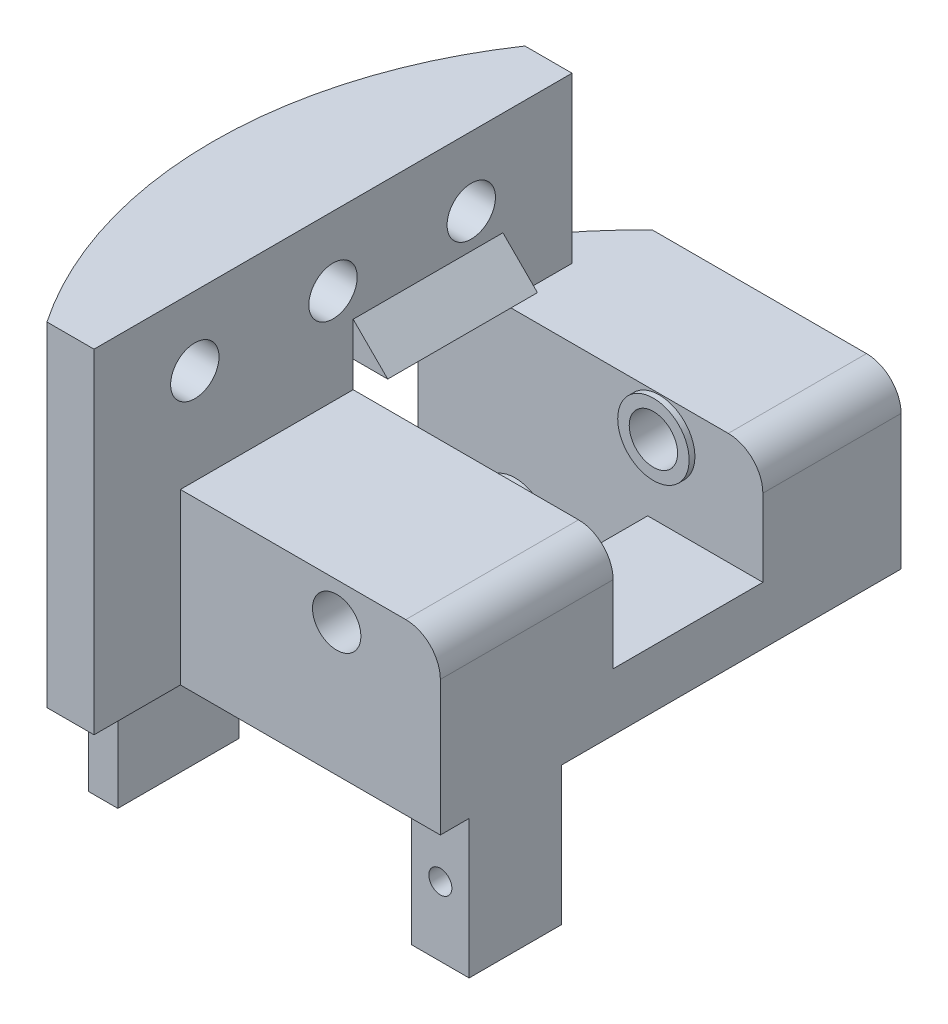
from build123d import *
from build123d.topology import SkipClean

# Parameters (mm, degrees)
BOSS_EXTRUDE1_DEPTH       = 12
SKETCH1_W                 = 5
SKETCH1_H                 = 8
BOSS_EXTRUDE1_2_DEPTH     = 12
BOSS_EXTRUDE2_DEPTH       = 17
F_2_0MM_DOWEL_HOLE1_D     = 2
F_2_0MM_DOWEL_HOLE1_DEPTH = 8
BOSS_EXTRUDE6_START       = -17
BOSS_EXTRUDE6_DEPTH       = 17
BOSS_EXTRUDE8_DEPTH       = 12
CUT_EXTRUDE2_REACH        = 70.191
SKETCH5_R                 = 2.1
CUT_EXTRUDE3_REACH        = 70.191
SKETCH19_W                = 22.567285658
SKETCH19_H                = 2.3
CUT_EXTRUDE5_START        = -2.3
CUT_EXTRUDE5_DEPTH        = 2.3
SKETCH21_W                = 10
SKETCH21_H                = 13
BOSS_EXTRUDE10_DEPTH      = 5
FILLET3_R                 = 3
SKETCH23_R                = 3.1
SKETCH23_R_2              = 2.1
BOSS_EXTRUDE11_DEPTH      = 0.5
CUT_EXTRUDE6_START        = -1.5
SKETCH24_W                = 5
SKETCH24_H                = 12
SKETCH24_R                = 1
CUT_EXTRUDE6_DEPTH        = 1.5
BOSS_EXTRUDE12_START      = -9.5
SKETCH24_2_W              = 5
SKETCH24_2_H              = 12
SKETCH24_2_R              = 1
BOSS_EXTRUDE12_DEPTH      = 1.5
F_2_0MM_DOWEL_HOLE2_D     = 4.2
BOSS_EXTRUDE13_START      = 17
BOSS_EXTRUDE13_DEPTH      = 17
BOSS_EXTRUDE14_DEPTH      = 13


with BuildPart() as part:
    # Sketch1 → Boss-Extrude1 (new body)
    with BuildSketch(Plane(origin=(0, 0, 0), x_dir=(1, 0, 0), z_dir=(0, 1, 0))):
        with BuildLine():
            Line((-31.978879107, -1.25), (-36.978879107, -1.25))
            ThreePointArc((-36.978879107, -1.25), (-36.262349279, -7.351328095), (-34.546164765, -13.25))
            Line((-34.546164765, -13.25), (-31.978879107, -13.25))
            Line((-31.978879107, -13.25), (-31.978879107, -1.25))
        make_face()
    extrude(amount=BOSS_EXTRUDE1_DEPTH)



with BuildPart() as body_2:
    # Sketch1 → Boss-Extrude1 2 (new body)
    with BuildSketch(Plane(origin=(0, 0, 0), x_dir=(1, 0, 0), z_dir=(0, 1, 0))):
        with Locations((-6.478879107, -5.25)):
            Rectangle(SKETCH1_W, SKETCH1_H)
    extrude(amount=BOSS_EXTRUDE1_2_DEPTH)


with BuildPart() as part_1:
    add(part.part)

    add(body_2.part)  # Boss-Extrude2 merges body 2
    # Sketch2 → Boss-Extrude2 (add)
    with BuildSketch(Plane(origin=(0, 12, 0), x_dir=(1, 0, 0), z_dir=(0, 1, 0))):
        with BuildLine():
            Line((-3.978879107, -13.25), (-3.978879107, 1.75))
            Line((-3.978879107, 1.75), (-36.958591694, 1.75))
            ThreePointArc((-36.958591694, 1.75), (-36.530570062, -5.875155396), (-34.546164765, -13.25))
            Line((-34.546164765, -13.25), (-3.978879107, -13.25))
        make_face()
    extrude(amount=BOSS_EXTRUDE2_DEPTH)

    # Ø2.0mm Dowel Hole1
    with Locations(Plane(origin=(0, 0, 1.25), x_dir=(-1, 0, 0), z_dir=(0, 0, -1))):
        with Locations((6.478879107, 6), (34.478879107, 6)):
            Hole(F_2_0MM_DOWEL_HOLE1_D / 2, depth=F_2_0MM_DOWEL_HOLE1_DEPTH)



with BuildPart() as body_2_2:
    # Sketch13 → Boss-Extrude6 (new body)
    with BuildSketch(Plane(origin=(0, 29, 0), x_dir=(1, 0, 0), z_dir=(0, 1, 0)).offset(BOSS_EXTRUDE6_START)):
        with BuildLine():
            Line((-33.932838078, 14.75), (-24.958591694, 14.75))
            Line((-24.958591694, 14.75), (-3.978879107, 14.75))
            Line((-3.978879107, 14.75), (-3.978879107, 26.75))
            Line((-3.978879107, 26.75), (-25.562423594, 26.75))
            ThreePointArc((-25.562423594, 26.75), (-30.346689117, 21.167863843), (-33.932838078, 14.75))
        make_face()
    extrude(amount=BOSS_EXTRUDE6_DEPTH)


with BuildPart() as part_2:
    add(part_1.part)

    add(body_2_2.part)  # Boss-Extrude8 merges body 2 2
    # Sketch17 → Boss-Extrude8 (add)
    with BuildSketch(Plane(origin=(0, 29, 0), x_dir=(1, 0, 0), z_dir=(0, 1, 0))):
        with BuildLine():
            Line((-26.546164765, -20.75), (-26.546164765, 20.75))
            Line((-26.546164765, 20.75), (-30.63392727, 20.75))
            ThreePointArc((-30.63392727, 20.75), (-37, 0), (-30.63392727, -20.75))
            Line((-30.63392727, -20.75), (-26.546164765, -20.75))
        make_face()
    extrude(amount=BOSS_EXTRUDE8_DEPTH)

    # Cut-Extrude2: up to this face of the body (flat: up to its plane)
    cut_extrude2_end = Plane(part_2.part.faces().sort_by_distance((-14.77065135, 20.5, -26.75))[0])
    # Sketch5 → Cut-Extrude2 (cut, up to the picked face)
    with BuildSketch(Plane.XY.offset(13.25), mode=Mode.PRIVATE) as cut_extrude2_sk1:
        with Locations((-12.978879107, 23.5)):
            Circle(SKETCH5_R)
    cut_extrude2_tool1 = split(extrude(cut_extrude2_sk1.sketch, amount=-CUT_EXTRUDE2_REACH, mode=Mode.PRIVATE), bisect_by=cut_extrude2_end, keep=Keep.BOTH, mode=Mode.PRIVATE)
    add(cut_extrude2_tool1.solids().sort_by(Axis((-12.978879, 23.5, 13.25), (0, 0, -1)))[0], mode=Mode.SUBTRACT)

    # Cut-Extrude3: up to this face of the body (flat: up to its plane)
    cut_extrude3_end = Plane(part_2.part.faces().sort_by_distance((-14.840961104, 20.382278978, -26.75))[0])
    # Sketch19 → Cut-Extrude3 (cut, up to the picked face)
    with BuildSketch(Plane.XY.offset(13.25), mode=Mode.PRIVATE) as cut_extrude3_sk1:
        with Locations((-15.262521936, 27.85)):
            Rectangle(SKETCH19_W, SKETCH19_H)
    cut_extrude3_tool1 = split(extrude(cut_extrude3_sk1.sketch, amount=-CUT_EXTRUDE3_REACH, mode=Mode.PRIVATE), bisect_by=cut_extrude3_end, keep=Keep.BOTH, mode=Mode.PRIVATE)
    add(cut_extrude3_tool1.solids().sort_by(Axis((-15.262522, 27.85, 13.25), (0, 0, -1)))[0], mode=Mode.SUBTRACT)

    # Sketch22 → Cut-Extrude5 (cut)
    with BuildSketch(Plane(origin=(0, 29, 0), x_dir=(1, 0, 0), z_dir=(0, 1, 0)).offset(CUT_EXTRUDE5_START)):
        with BuildLine():
            Line((-26.546164765, 20.75), (-26.546164765, 25.774039968))
            ThreePointArc((-26.546164765, 25.774039968), (-28.700191214, 23.351638578), (-30.63392727, 20.75))
            Line((-30.63392727, 20.75), (-26.546164765, 20.75))
        make_face()
    extrude(amount=CUT_EXTRUDE5_DEPTH, mode=Mode.SUBTRACT)

    # Sketch21 → Boss-Extrude10 (add)
    with BuildSketch(Plane.XZ.offset(-12)):
        with Locations((-8.978879107, -8.25)):
            Rectangle(SKETCH21_W, SKETCH21_H)
    extrude(amount=-BOSS_EXTRUDE10_DEPTH)

    # Fillet3
    fillet3_edges = [part_2.edges().sort_by_distance(p)[0] for p in [
        (-3.978879107, 26.7, -20.75),
        (-3.978879107, 26.7, 5.75),
    ]]
    fillet(fillet3_edges, radius=FILLET3_R)

    # Sketch23 → Boss-Extrude11 (add)
    with BuildSketch(Plane(origin=(0, 0, -1.75), x_dir=(-1, 0, 0), z_dir=(0, 0, -1))):
        with Locations(Location((12.978879107, 23.5, 0), (0, 0, 180))):
            Circle(SKETCH23_R)
        with Locations(Location((12.978879107, 23.5, 0), (0, 0, 180))):
            Circle(SKETCH23_R_2, mode=Mode.SUBTRACT)
    boss_extrude11 = extrude(amount=BOSS_EXTRUDE11_DEPTH)

    # Mirror4: Boss-Extrude11 across plane
    add(boss_extrude11.mirror(Plane.XY.offset(-8.25)))

    # Sketch24 → Cut-Extrude6 (cut)
    # profile 1 of 2: a face of its own
    with BuildSketch(Plane(origin=(0, 0, 1.25), x_dir=(-1, 0, 0), z_dir=(0, 0, -1)).offset(CUT_EXTRUDE6_START)):
        with Locations((34.478879107, 6)):
            Rectangle(SKETCH24_W, SKETCH24_H)
        with Locations((34.478879107, 6)):
            Circle(SKETCH24_R, mode=Mode.SUBTRACT)
    # profile 2 of 2: a face of its own
    with BuildSketch(Plane(origin=(0, 0, 1.25), x_dir=(-1, 0, 0), z_dir=(0, 0, -1)).offset(CUT_EXTRUDE6_START)):
        with Locations((6.478879107, 6)):
            Rectangle(SKETCH24_W, SKETCH24_H)
        with Locations((6.478879107, 6)):
            Circle(SKETCH24_R, mode=Mode.SUBTRACT)
    extrude(amount=CUT_EXTRUDE6_DEPTH, mode=Mode.SUBTRACT)

    # Sketch24<2> → Boss-Extrude12 (add)
    with BuildSketch(Plane(origin=(0, 0, 1.25), x_dir=(-1, 0, 0), z_dir=(0, 0, -1)).offset(BOSS_EXTRUDE12_START)):
        with Locations((6.478879107, 6)):
            Rectangle(SKETCH24_2_W, SKETCH24_2_H)
        with Locations((6.478879107, 6)):
            Circle(SKETCH24_2_R, mode=Mode.SUBTRACT)
    extrude(amount=BOSS_EXTRUDE12_DEPTH)

    # Ø2.0mm Dowel Hole2 (through all)
    with Locations(Plane(origin=(-26.546164765, 0, 0), x_dir=(0, 0, -1), z_dir=(1, 0, 0))):
        with Locations((-12, 35), (0, 35), (12, 35)):
            Hole(F_2_0MM_DOWEL_HOLE2_D / 2)

    # Sketch27 → Boss-Extrude13 (add)
    with SkipClean():  # the faces are left unmerged after this step: merging them gives an invalid solid
        with BuildSketch(Plane.XZ.offset(-29).offset(BOSS_EXTRUDE13_START)):
            with BuildLine():
                Line((-34.546164765, 13.25), (-26.546164765, 13.25))
                Line((-26.546164765, 13.25), (-26.546164765, 20.75))
                Line((-26.546164765, 20.75), (-30.63392727, 20.75))
                ThreePointArc((-30.63392727, 20.75), (-32.805084963, 17.112171123), (-34.546164765, 13.25))
            make_face()
        extrude(amount=-BOSS_EXTRUDE13_DEPTH)

    # Sketch28 → Boss-Extrude14 (add)
    with SkipClean():  # the faces are left unmerged after this step: merging them gives an invalid solid
        with BuildSketch(Plane(origin=(0, 0, -1.75), x_dir=(-1, 0, 0), z_dir=(0, 0, -1))):
            Polygon((26.546164765, 29), (23.546164765, 29), (26.546164765, 32), align=None)
        extrude(amount=BOSS_EXTRUDE14_DEPTH)


solid = part_2.part
